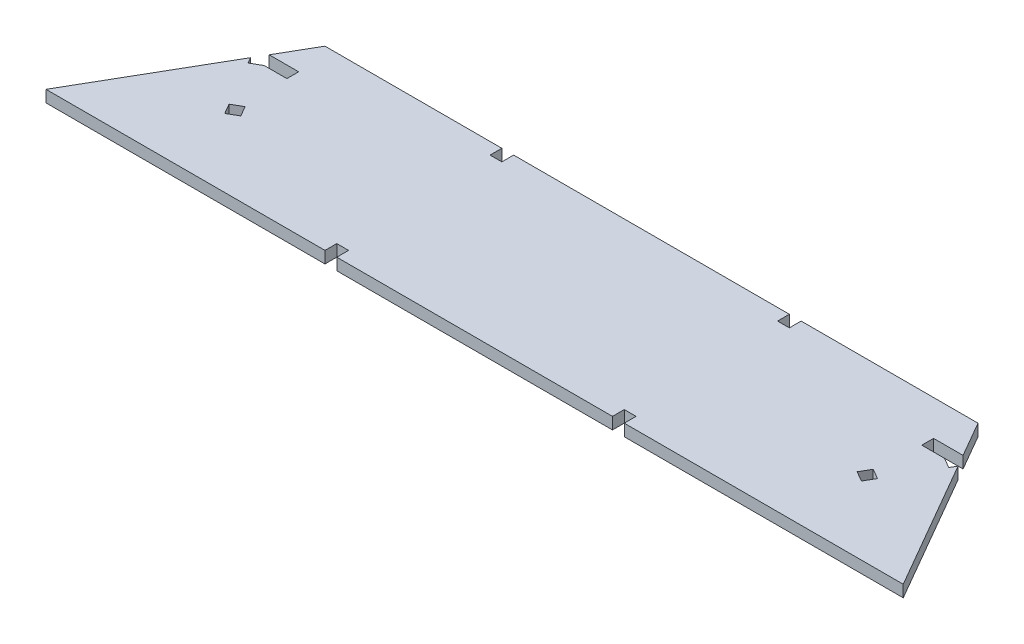
from build123d import *

# Parameters (mm, degrees)
BOSS_EXTRUDE1_DEPTH = 12.7
SKETCH2_OUTSIDE_W   = 2337.202
SKETCH2_OUTSIDE_H   = 2089.8
CUT_EXTRUDE1_DEPTH  = 12.7
SKETCH3_W           = 12.7
SKETCH3_H           = 12.7
CUT_EXTRUDE2_DEPTH  = 12.7
CUT_EXTRUDE3_DEPTH  = 12.7


with BuildPart() as part:
    # Sketch1 → Boss-Extrude1 (new body)
    with BuildSketch(Plane(origin=(0, 609.6, 0), x_dir=(1, 0, 0), z_dir=(0, 1, 0))):
        Polygon((923.311665212, 0), (461.655832606, 799.611357684), (-461.655832606, 799.611357684), (-923.311665212, 0), (-461.655832606, -799.611357684), (461.655832606, -799.611357684), align=None)
        Polygon((-351.670606325, 609.111357684), (-703.34121265, 0), (-351.670606325, -609.111357684), (351.670606325, -609.111357684), (703.34121265, 0), (351.670606325, 609.111357684), align=None, mode=Mode.SUBTRACT)
    extrude(amount=-BOSS_EXTRUDE1_DEPTH)

    # Sketch2 outside → Cut-Extrude1 (cut)
    with BuildSketch(Plane(origin=(0, 609.6, 0), x_dir=(1, 0, 0), z_dir=(0, 1, 0))):
        Rectangle(SKETCH2_OUTSIDE_W, SKETCH2_OUTSIDE_H)
        Polygon((-351.670606325, -609.111357684), (-461.655832606, -799.611357684), (461.655832606, -799.611357684), (351.670606325, -609.111357684), align=None, mode=Mode.SUBTRACT)
    extrude(amount=-CUT_EXTRUDE1_DEPTH, mode=Mode.SUBTRACT)

    # Sketch3 → Cut-Extrude2 (cut)
    with BuildSketch(Plane(origin=(0, 609.6, 0), x_dir=(1, 0, 0), z_dir=(0, 1, 0))):
        with Locations((-154.820606325, -615.461357684)):
            Rectangle(SKETCH3_W, SKETCH3_H)
        Polygon((-342.9, -725.902493452), (-331.901477372, -719.552493452), (-338.251477372, -708.553970824), (-349.25, -714.903970824), align=None)
        with Locations((-154.820606325, -793.261357684)):
            Rectangle(SKETCH3_W, SKETCH3_H)
        Polygon((-373.667651581, -647.211357684), (-381, -659.911357684), (-377.333825791, -666.261357684), (-366.335303163, -659.911357684), align=None)
        Polygon((381, -659.911357684), (373.667651581, -647.211357684), (366.335303163, -659.911357684), (377.333825791, -666.261357684), align=None)
        Polygon((338.251477372, -708.553970824), (331.901477372, -719.552493452), (342.9, -725.902493452), (349.25, -714.903970824), align=None)
        with Locations((154.820606325, -615.461357684)):
            Rectangle(SKETCH3_W, SKETCH3_H)
        with Locations((154.820606325, -793.261357684)):
            Rectangle(SKETCH3_W, SKETCH3_H)
    extrude(amount=-CUT_EXTRUDE2_DEPTH, mode=Mode.SUBTRACT)

    # Sketch4 → Cut-Extrude3 (cut)
    with BuildSketch(Plane(origin=(0, 609.6, 0), x_dir=(1, 0, 0), z_dir=(0, 1, 0))):
        Polygon((366.335303163, -659.911357684), (373.667651581, -647.211357684), (341.917651581, -647.211357684), (341.917651581, -659.911357684), align=None)
        Polygon((-373.667651581, -647.211357684), (-341.917651581, -647.211357684), (-341.917651581, -659.911357684), (-366.335303163, -659.911357684), align=None)
    extrude(amount=-CUT_EXTRUDE3_DEPTH, mode=Mode.SUBTRACT)


solid = part.part
